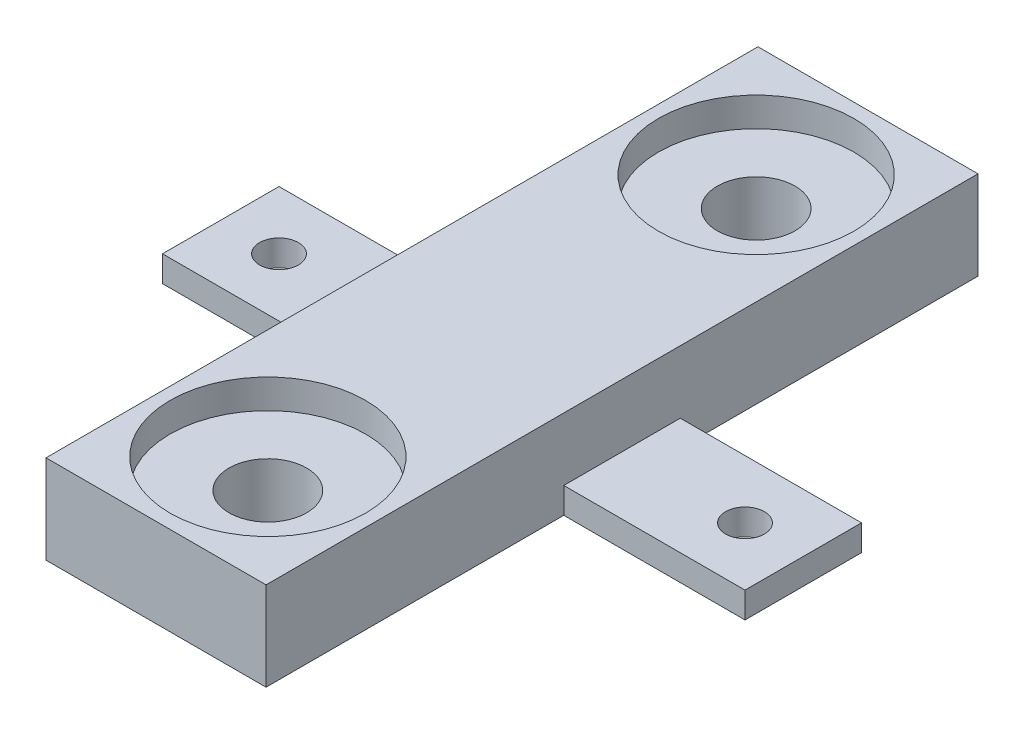
from build123d import *

# Parameters (mm, degrees)
SKETCH1_W           = 17
SKETCH1_H           = 55
SKETCH1_R           = 7.55
SKETCH1_W_2         = 14
SKETCH1_H_2         = 9
SKETCH1_R_2         = 1.5
BOSS_EXTRUDE1_DEPTH = 2
BOSS_EXTRUDE2_START = 2
SKETCH1_4_W         = 17
SKETCH1_4_H         = 55
SKETCH1_4_R         = 7.55
BOSS_EXTRUDE2_DEPTH = 2.6
BOSS_EXTRUDE3_START = 4.6
SKETCH1_5_W         = 17
SKETCH1_5_H         = 55
SKETCH1_5_R         = 7.55
BOSS_EXTRUDE3_DEPTH = 2.25
SKETCH3_R           = 3
CUT_EXTRUDE1_DEPTH  = 37.185943403


with BuildPart() as part:
    # Sketch1 → Boss-Extrude1 (new body)
    # profile 1 of 5: a face of its own
    with BuildSketch(Plane(origin=(0, 0, 0), x_dir=(1, 0, 0), z_dir=(0, 1, 0))):
        Rectangle(SKETCH1_W, SKETCH1_H)
        with Locations((0, -18.8625)):
            Circle(SKETCH1_R, mode=Mode.SUBTRACT)
        with Locations((0, 18.8625)):
            Circle(SKETCH1_R, mode=Mode.SUBTRACT)
    # profile 2 of 5: a face of its own
    with BuildSketch(Plane(origin=(0, 0, 0), x_dir=(1, 0, 0), z_dir=(0, 1, 0))):
        with Locations((15.5, 0)):
            Rectangle(SKETCH1_W_2, SKETCH1_H_2)
        with Locations(Location((18, 0, 0), (0, 0, 270))):
            Circle(SKETCH1_R_2, mode=Mode.SUBTRACT)
    # profile 3 of 5: a face of its own
    with BuildSketch(Plane(origin=(0, 0, 0), x_dir=(1, 0, 0), z_dir=(0, 1, 0))):
        with Locations((-15.5, 0)):
            Rectangle(SKETCH1_W_2, SKETCH1_H_2)
        with Locations(Location((-18, 0, 0), (0, 0, 270))):
            Circle(SKETCH1_R_2, mode=Mode.SUBTRACT)
    # profile 4 of 5: a face of its own
    with BuildSketch(Plane(origin=(0, 0, 0), x_dir=(1, 0, 0), z_dir=(0, 1, 0))):
        with Locations((0, -18.8625)):
            Circle(SKETCH1_R)
    # profile 5 of 5: a face of its own
    with BuildSketch(Plane(origin=(0, 0, 0), x_dir=(1, 0, 0), z_dir=(0, 1, 0))):
        with Locations((0, 18.8625)):
            Circle(SKETCH1_R)
    extrude(amount=BOSS_EXTRUDE1_DEPTH)

    # Sketch1<4> → Boss-Extrude2 (add)
    # profile 1 of 3: a face of its own
    with BuildSketch(Plane(origin=(0, 0, 0), x_dir=(1, 0, 0), z_dir=(0, 1, 0)).offset(BOSS_EXTRUDE2_START)):
        Rectangle(SKETCH1_4_W, SKETCH1_4_H)
        with Locations((0, -18.8625)):
            Circle(SKETCH1_4_R, mode=Mode.SUBTRACT)
        with Locations((0, 18.8625)):
            Circle(SKETCH1_4_R, mode=Mode.SUBTRACT)
    # profile 2 of 3: a face of its own
    with BuildSketch(Plane(origin=(0, 0, 0), x_dir=(1, 0, 0), z_dir=(0, 1, 0)).offset(BOSS_EXTRUDE2_START)):
        with Locations((0, -18.8625)):
            Circle(SKETCH1_4_R)
    # profile 3 of 3: a face of its own
    with BuildSketch(Plane(origin=(0, 0, 0), x_dir=(1, 0, 0), z_dir=(0, 1, 0)).offset(BOSS_EXTRUDE2_START)):
        with Locations((0, 18.8625)):
            Circle(SKETCH1_4_R)
    extrude(amount=BOSS_EXTRUDE2_DEPTH)

    # Sketch1<5> → Boss-Extrude3 (add)
    with BuildSketch(Plane(origin=(0, 0, 0), x_dir=(1, 0, 0), z_dir=(0, 1, 0)).offset(BOSS_EXTRUDE3_START)):
        Rectangle(SKETCH1_5_W, SKETCH1_5_H)
        with Locations(Location((0, -18.8625, 0), (0, 0, 90))):
            Circle(SKETCH1_5_R, mode=Mode.SUBTRACT)
        with Locations(Location((0, 18.8625, 0), (0, 0, 90))):
            Circle(SKETCH1_5_R, mode=Mode.SUBTRACT)
    extrude(amount=BOSS_EXTRUDE3_DEPTH)

    # Sketch3 → Cut-Extrude1 (cut, through all)
    with BuildSketch(Plane.XZ):
        with Locations(Location((0, -18.8625, 0), (0, 0, 270))):
            Circle(SKETCH3_R)
        with Locations(Location((0, 18.8625, 0), (0, 0, 270))):
            Circle(SKETCH3_R)
    extrude(amount=-CUT_EXTRUDE1_DEPTH, mode=Mode.SUBTRACT)


solid = part.part
